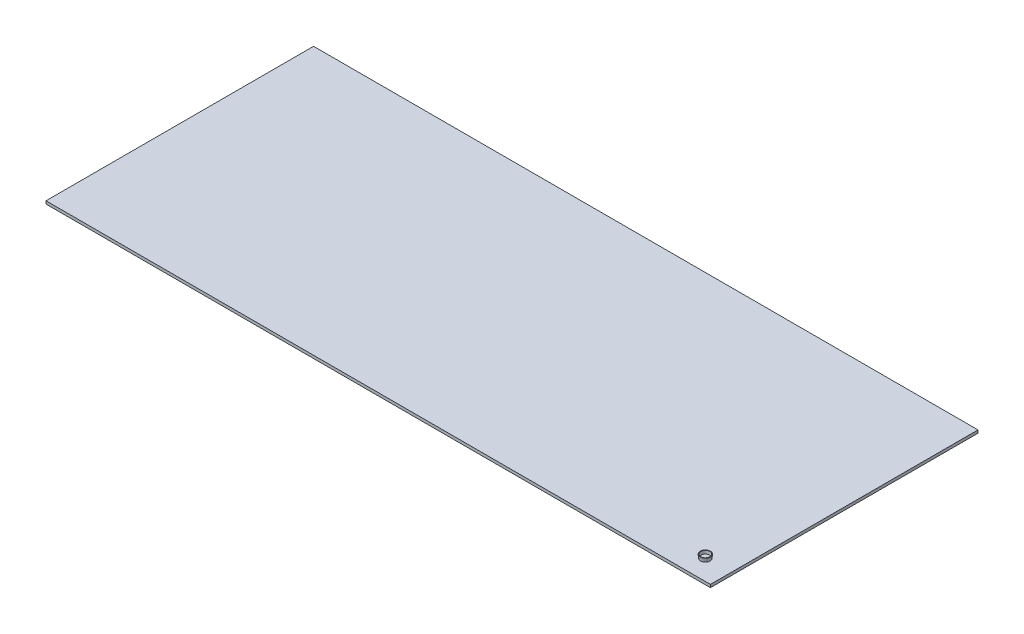
from build123d import *

# Parameters (mm, degrees)
SKETCH1_W           = 276.99982026
SKETCH1_H           = 111.55517974
BOSS_EXTRUDE1_DEPTH = 0.6


with BuildPart() as part:
    # Sketch1 → Boss-Extrude1 (new, symmetric)
    with BuildSketch(Plane(origin=(0, 0, 0), x_dir=(1, 0, 0), z_dir=(0, 1, 0))):
        with Locations((-1.3e-07, -30.600952381)):
            Rectangle(SKETCH1_W, SKETCH1_H)
    extrude(amount=BOSS_EXTRUDE1_DEPTH, both=True)

    # Sketch2 → Revolve1 (revolve)
    with BuildSketch(Plane(origin=(0, 0, 78.003542251), x_dir=(-1, 0, 0), z_dir=(0, 0, -1)), mode=Mode.PRIVATE) as revolve1_sk:
        Polygon((-127.99991, 0.6), (-125.99991, 0.6), (-125.868677005, 2.1), (-126.118677005, 2.1), (-126.228037834, 0.85), (-127.99991, 0.85), align=None)
    revolve(revolve1_sk.sketch.rotate(Axis((127.99991, -51.532801272, 78.003542251), (0, 1, 0)), 90), axis=Axis((127.99991, -51.532801272, 78.003542251), (0, 1, 0)))

    # Sketch4 → Cut-Revolve1 (revolve, cut)
    with BuildSketch(Plane(origin=(0, 0, 78.003542251), x_dir=(-1, 0, 0), z_dir=(0, 0, -1)), mode=Mode.PRIVATE) as cut_revolve1_sk:
        Polygon((-129.894923604, -0.6), (-129.99991, 0.6), (-127.99991, 0.6), (-127.99991, -0.6), align=None)
    revolve(cut_revolve1_sk.sketch.rotate(Axis((127.99991, -51.532801272, 78.003542251), (0, 1, 0)), 90), axis=Axis((127.99991, -51.532801272, 78.003542251), (0, 1, 0)), mode=Mode.SUBTRACT)


with BuildPart() as cut_revolve1_piece_1:
    # of the separate pieces the step leaves, piece 1, a body of its own (cut_revolve1_pieces)
    add(part.part.solids().sort_by_distance((138.49991, -0.6, 86.378542251))[0])


with BuildPart() as cut_revolve1_piece_2:
    # of the separate pieces the step leaves, piece 2, a body of its own (cut_revolve1_pieces)
    add(part.part.solids().sort_by_distance((127.99991, 2.1, 80.134775246))[0])


solid = Compound([cut_revolve1_piece_1.part, cut_revolve1_piece_2.part])
